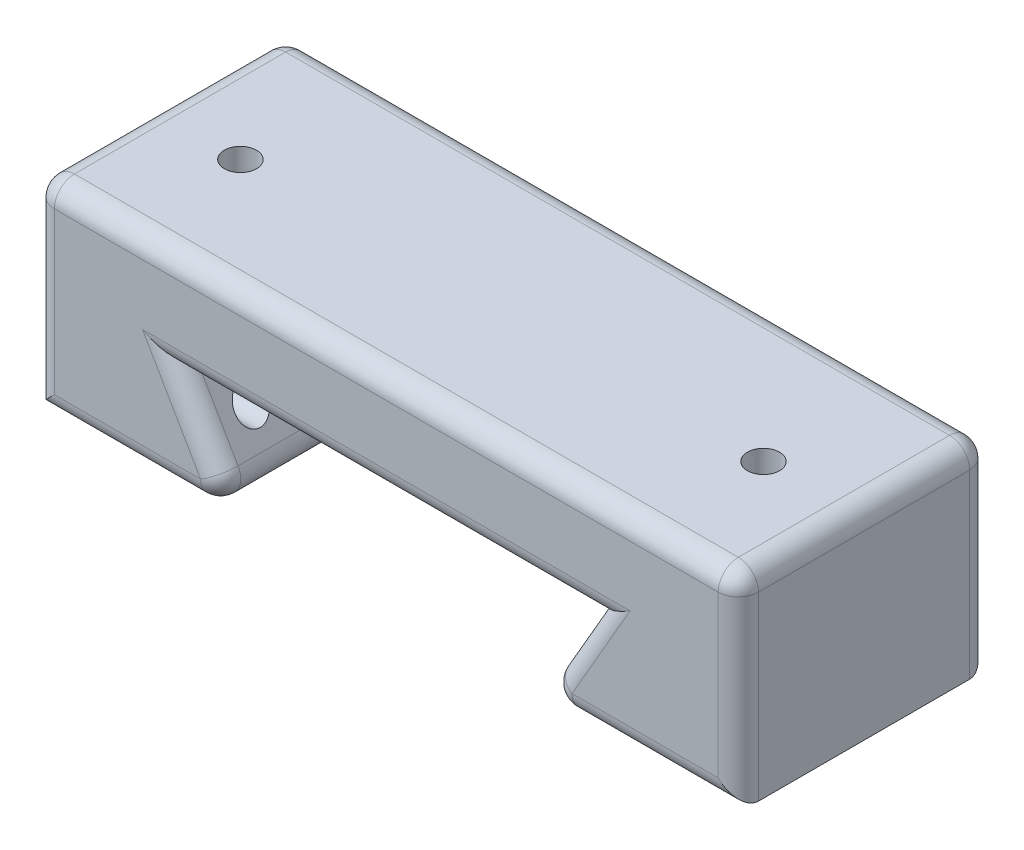
from build123d import *

# Parameters (mm, degrees)
SKETCH1_W           = 70
SKETCH1_H           = 25
SKETCH1_R           = 1.6
BOSS_EXTRUDE1_DEPTH = 10
BOSS_EXTRUDE2_DEPTH = 25
SKETCH3_R           = 3
CUT_EXTRUDE1_DEPTH  = 39.487010796
FILLET1_R           = 2
SKETCH6_R           = 1.6
CUT_EXTRUDE3_DEPTH  = 27
SKETCH7_W           = 2.6
SKETCH7_H           = 6
CUT_EXTRUDE4_DEPTH  = 11.25


with BuildPart() as part:
    # Sketch1 → Boss-Extrude1 (new body)
    with BuildSketch(Plane(origin=(0, 0, 0), x_dir=(1, 0, 0), z_dir=(0, 1, 0))):
        Rectangle(SKETCH1_W, SKETCH1_H)
        with Locations(Location((-26, -1, 0), (0, 0, 270))):
            Circle(SKETCH1_R, mode=Mode.SUBTRACT)
        with Locations(Location((26, -1, 0), (0, 0, 270))):
            Circle(SKETCH1_R, mode=Mode.SUBTRACT)
    extrude(amount=BOSS_EXTRUDE1_DEPTH)

    # Sketch2 → Boss-Extrude2 (add)
    with BuildSketch(Plane.XY.offset(12.5)):
        Polygon((-35, 0), (-20.773502692, 0), (-15, -10), (-35, -10), align=None)
        Polygon((35, 0), (35, -10), (15, -10), (20.773502692, 0), align=None)
    extrude(amount=-BOSS_EXTRUDE2_DEPTH)

    # Sketch3 → Cut-Extrude1 (cut, through all)
    with BuildSketch(Plane.XZ):
        with Locations(Location((-26, 1, 0), (0, 0, 270))):
            Circle(SKETCH3_R)
        with Locations(Location((26, 1, 0), (0, 0, 270))):
            Circle(SKETCH3_R)
    extrude(amount=CUT_EXTRUDE1_DEPTH, mode=Mode.SUBTRACT)

    # Fillet1
    fillet1_edges = [part.edges().sort_by_distance(p)[0] for p in [
        (35, 10, 0),
        (0, 10, -12.5),
        (0, 0, -12.5),
        (0, 0, 12.5),
        (-17.886751346, -5, -12.5),
        (-25, -10, -12.5),
        (-15, -10, 0),
        (-25, -10, 12.5),
        (-17.886751346, -5, 12.5),
        (25, -10, -12.5),
        (17.886751346, -5, -12.5),
        (15, -10, 0),
        (25, -10, 12.5),
        (17.886751346, -5, 12.5),
        (-35, 10, 0),
        (-35, 0, -12.5),
        (35, 0, -12.5),
        (35, 0, 12.5),
        (-35, 0, 12.5),
        (0, 10, 12.5),
    ]]
    fillet(fillet1_edges, radius=FILLET1_R)

    # Sketch6 → Cut-Extrude3 (cut)
    with BuildSketch(Plane.ZY.offset(35)):
        with Locations((-8.5, -4)):
            Circle(SKETCH6_R)
        with Locations((7.5, -4)):
            Circle(SKETCH6_R)
    extrude(amount=-CUT_EXTRUDE3_DEPTH, mode=Mode.SUBTRACT)

    # Sketch7 → Cut-Extrude4 (cut)
    with BuildSketch(Plane.XZ.offset(10)):
        with Locations((-30, -8.5)):
            Rectangle(SKETCH7_W, SKETCH7_H)
        with Locations((-30, 7.5)):
            Rectangle(SKETCH7_W, SKETCH7_H)
    extrude(amount=-CUT_EXTRUDE4_DEPTH, mode=Mode.SUBTRACT)


solid = part.part
